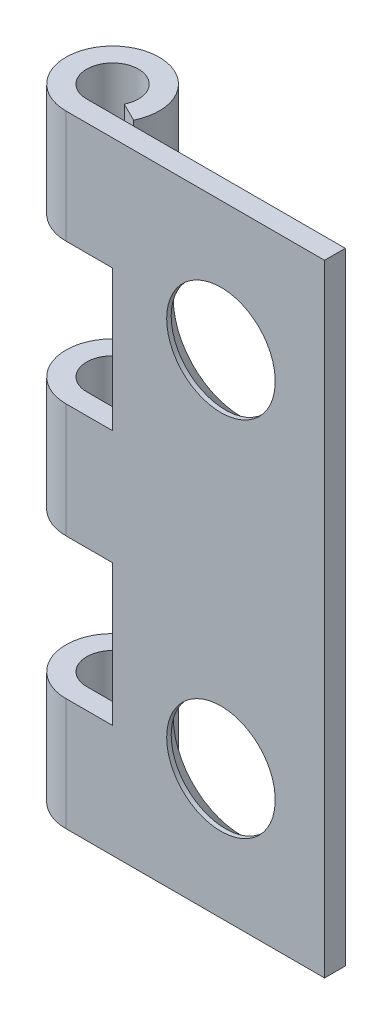
from build123d import *

# Parameters (mm, degrees)
EXTRUDE1_DEPTH          = 9.525
LPATTERN2_COUNT         = 2
LPATTERN2_PITCH         = 11.1125
CUT_EXTRUDE1_DEPTH      = 13.472746554
CUT_EXTRUDE1_DEPTH_BACK = 13.472746554
SKETCH4_W               = 2.8575
SKETCH4_H               = 4.318


with BuildPart() as part:
    # Sketch1 → Extrude1 (new, symmetric)
    with BuildSketch(Plane(origin=(0, 0, 0), x_dir=(1, 0, 0), z_dir=(0, 1, 0))):
        with BuildLine():
            Line((0, -0.79375), (7.9248, -0.79375))
            Line((7.9248, -0.79375), (7.9248, -1.42875))
            Line((7.9248, -1.42875), (0, -1.42875))
            ThreePointArc((0, -1.42875), (-0.753017368, 1.214204022), (1.279883418, -0.635))
            Line((1.279883418, -0.635), (0.711046343, -0.352777778))
            ThreePointArc((0.711046343, -0.352777778), (-0.418342982, 0.67455779), (0, -0.79375))
        make_face()
    extrude(amount=EXTRUDE1_DEPTH, both=True)

    # Sketch7 → Cut-Revolve1 (revolve, cut)
    with BuildSketch(Plane(origin=(4.7498, 0, 0), x_dir=(0, 0, -1), z_dir=(1, 0, 0)), mode=Mode.PRIVATE) as cut_revolve1_sk:
        Polygon((-0.79375, 5.55625), (-0.79375, 7.65175), (-1.290479078, 7.21995), (-1.42875, 7.21995), (-1.42875, 5.55625), align=None)
    cut_revolve1 = revolve(cut_revolve1_sk.sketch.rotate(Axis((4.7498, 5.55625, -1.822321443), (0, 0, 1)), 90), axis=Axis((4.7498, 5.55625, -1.822321443), (0, 0, 1)), mode=Mode.SUBTRACT)

    # LPattern2: Cut-Revolve1 ×2
    with Locations(*[(0, -i * LPATTERN2_PITCH, 0) for i in range(1, LPATTERN2_COUNT)]):
        add(cut_revolve1, mode=Mode.SUBTRACT)

    # Sketch4 → Cut-Extrude1 (cut, two sides: drawn at the far end of the back side and taken through both)
    with BuildSketch(Plane.XY.offset(-CUT_EXTRUDE1_DEPTH_BACK)):
        with Locations((0, 3.9116)):
            Rectangle(SKETCH4_W, SKETCH4_H)
        with Locations((0, -3.9116)):
            Rectangle(SKETCH4_W, SKETCH4_H)
    extrude(amount=CUT_EXTRUDE1_DEPTH + CUT_EXTRUDE1_DEPTH_BACK, mode=Mode.SUBTRACT)


solid = part.part
